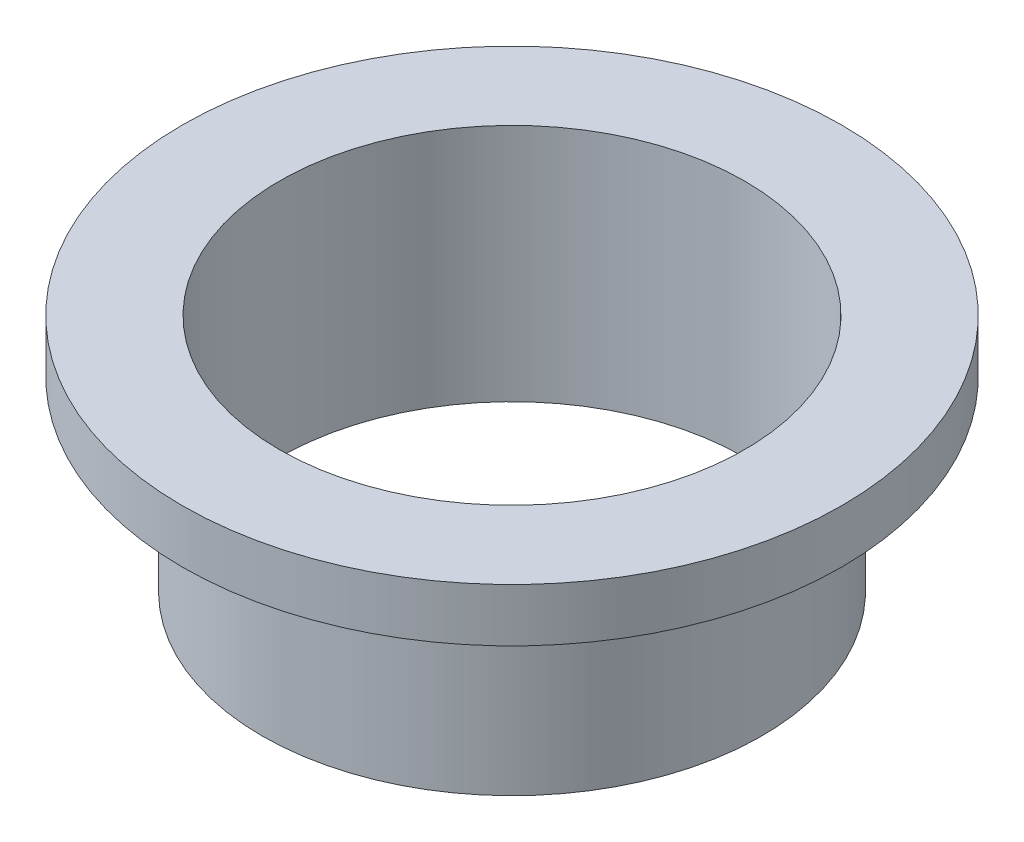
from build123d import *

# Parameters (mm, degrees)
SKETCH1_R           = 12.4
SKETCH1_R_2         = 8.75
BOSS_EXTRUDE1_DEPTH = 2
BOSS_EXTRUDE2_START = -7
SKETCH1_3_R         = 9.4
SKETCH1_3_R_2       = 8.75
BOSS_EXTRUDE2_DEPTH = 7


with BuildPart() as part:
    # Sketch1 → Boss-Extrude1 (new body)
    with BuildSketch(Plane(origin=(0, 0, 0), x_dir=(1, 0, 0), z_dir=(0, 1, 0))):
        Circle(SKETCH1_R)
        Circle(SKETCH1_R_2, mode=Mode.SUBTRACT)
    extrude(amount=BOSS_EXTRUDE1_DEPTH)

    # Sketch1<3> → Boss-Extrude2 (add)
    with BuildSketch(Plane(origin=(0, 0, 0), x_dir=(1, 0, 0), z_dir=(0, 1, 0)).offset(BOSS_EXTRUDE2_START)):
        Circle(SKETCH1_3_R)
        Circle(SKETCH1_3_R_2, mode=Mode.SUBTRACT)
    extrude(amount=BOSS_EXTRUDE2_DEPTH)


solid = part.part
